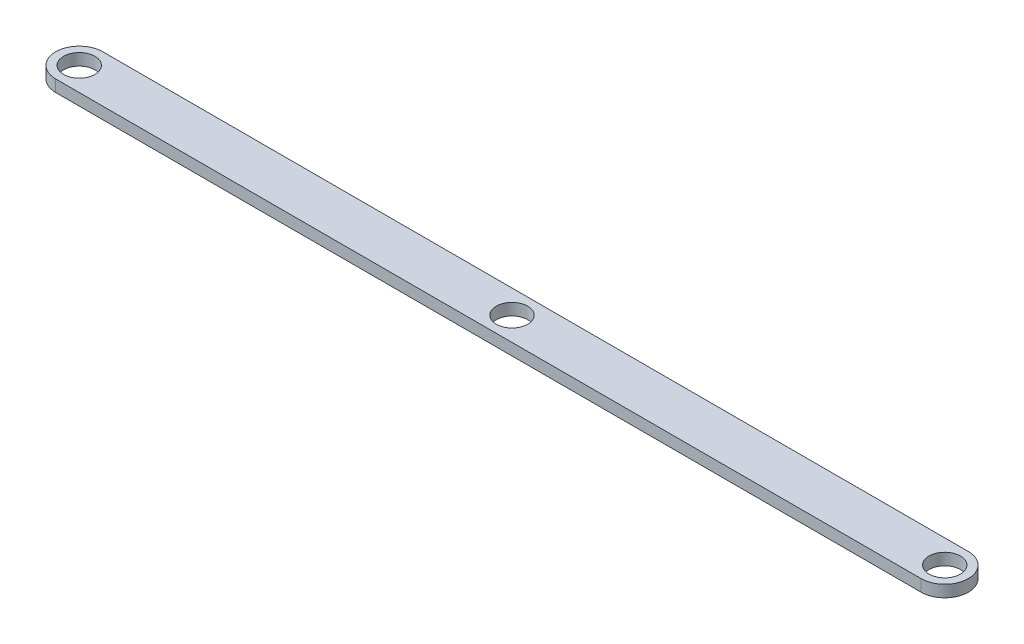
from build123d import *

# Parameters (mm, degrees)
SKETCH1_R           = 3.175
BOSS_EXTRUDE1_DEPTH = 2.38125


with BuildPart() as part:
    # Sketch1 → Boss-Extrude1 (new body)
    with BuildSketch(Plane(origin=(0, 0, 0), x_dir=(1, 0, 0), z_dir=(0, 1, 0))):
        with BuildLine():
            Line((-87.5, -4.7625), (87.5, -4.7625))
            ThreePointArc((87.5, -4.7625), (92.2625, 0), (87.5, 4.7625))
            Line((87.5, 4.7625), (-87.5, 4.7625))
            ThreePointArc((-87.5, 4.7625), (-92.2625, 0), (-87.5, -4.7625))
        make_face()
        with Locations(Location((-87.5, 0, 0), (0, 0, 90))):
            Circle(SKETCH1_R, mode=Mode.SUBTRACT)
        with Locations(Location((87.5, 0, 0), (0, 0, 90))):
            Circle(SKETCH1_R, mode=Mode.SUBTRACT)
        with Locations(Location((0, 0, 0), (0, 0, 90))):
            Circle(SKETCH1_R, mode=Mode.SUBTRACT)
    extrude(amount=BOSS_EXTRUDE1_DEPTH)


solid = part.part
